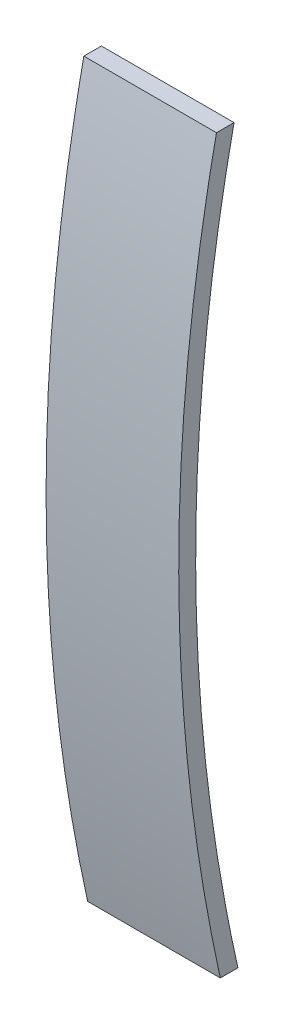
from build123d import *

# Parameters (mm, degrees)
SKETCH2_W           = 381
SKETCH2_H           = 2108.2
BOSS_EXTRUDE1_DEPTH = 254
CUT_EXTRUDE1_DEPTH  = 2158.355844547


with BuildPart() as part:
    # Sketch2 → Boss-Extrude1 (new, symmetric)
    with BuildSketch(Plane.XY):
        with Locations((190.5, 1054.1)):
            Rectangle(SKETCH2_W, SKETCH2_H)
    extrude(amount=BOSS_EXTRUDE1_DEPTH, both=True)

    # Sketch3 → Cut-Extrude1 (cut, through all)
    with BuildSketch(Plane.ZY):
        with BuildLine():
            Line((11.150438367, 2108.2), (-254, 2108.2))
            Line((-254, 2108.2), (-254, 0))
            Line((-254, 0), (0, 0))
            add(Edge.make_bspline(
                [(11.150438367, 2108.2), (46.030524159, 1945.372158046), (72.936763616, 1781.142202182), (92.741027925, 1603.729087385), (94.005716861, 1592.016041361), (96.449342775, 1568.589911804), (99.986742222, 1533.445609992), (107.343585427, 1451.406454342), (112.108799831, 1381.025721695), (119.577633775, 1240.18201965), (121.808049281, 1146.176568729), (121.135613979, 1028.531717992), (120.674350909, 993.227910054), (119.823106534, 957.908545813), (119.16887214, 934.358843012), (118.79850277, 922.586879756), (116.731703037, 863.764731081), (114.389789584, 816.804237017), (105.324111183, 676.210830806), (96.560552157, 582.865974306), (64.947693014, 325.441305718), (36.450675371, 162.159053026), (0, 0)],
                knots=[0.028788399, 0.028788399, 0.028788399, 0.028788399, 0.25, 0.25, 0.265625, 0.265625, 0.28125, 0.3125, 0.375, 0.375, 0.5, 0.5, 0.53125, 0.546875, 0.546875, 0.5625, 0.5625, 0.625, 0.625, 0.75, 0.75, 0.971112085, 0.971112085, 0.971112085, 0.971112085], degree=3))
        make_face()
        with BuildLine():
            Line((254, 0), (50.576334074, 0))
            add(Edge.make_bspline(
                [(50.576334074, 0), (86.528070574, 162.415354186), (114.606351628, 325.911171886), (145.724683166, 583.578560023), (154.342567016, 676.984692023), (161.763396997, 794.202282187), (163.738263909, 829.402056056), (165.333827162, 864.653881246), (166.312996166, 888.166699325), (166.760214296, 899.926998719), (168.78309537, 958.712785523), (169.720514345, 1005.723486353), (170.494777038, 1146.701925792), (168.293632391, 1240.616001508), (160.934483304, 1381.380277597), (157.022870989, 1440.009801444), (152.05703473, 1498.611566197), (149.986410123, 1522.05005263), (148.908777339, 1533.769959678), (145.551282696, 1568.908236744), (143.146684403, 1592.3074259), (122.385028935, 1781.143924842), (95.919442052, 1945.297235948), (61.55657451, 2108.2)],
                knots=[0.028846642, 0.028846642, 0.028846642, 0.028846642, 0.25, 0.25, 0.375, 0.375, 0.40625, 0.421875, 0.421875, 0.4375, 0.4375, 0.5, 0.5, 0.625, 0.625, 0.6875, 0.703125, 0.703125, 0.71875, 0.71875, 0.75, 0.75, 0.971226417, 0.971226417, 0.971226417, 0.971226417], degree=3))
            Line((61.55657451, 2108.2), (254, 2108.2))
            Line((254, 2108.2), (254, 0))
        make_face()
    extrude(amount=-CUT_EXTRUDE1_DEPTH, mode=Mode.SUBTRACT)


solid = part.part
